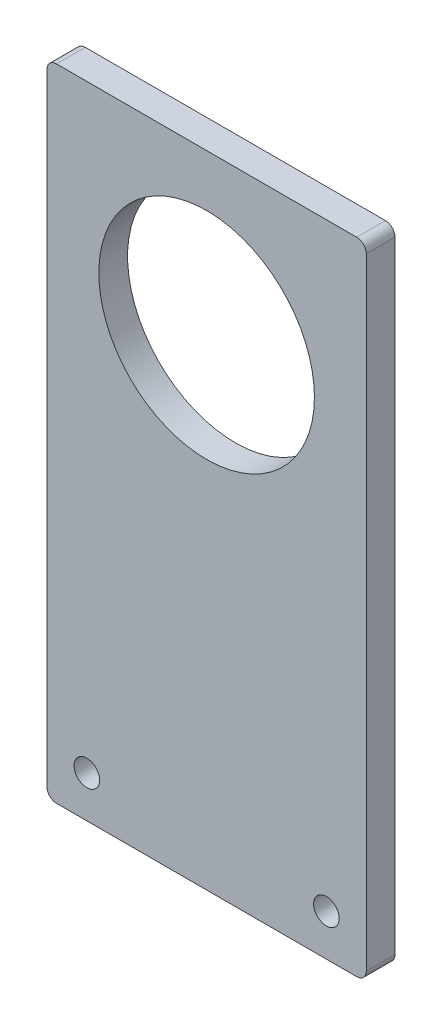
from build123d import *

# Parameters (mm, degrees)
SKETCH_1_R          = 6.75
EXTRUDE_1_DEPTH     = 1.8
SKETCH_2_R          = 0.8
CUT_EXTRUDE_1_DEPTH = 2
SKETCH_3_R          = 1.75
CUT_EXTRUDE_2_DEPTH = 0.5
CUT_EXTRUDE_4_DEPTH = 10
SKETCH_6_R          = 1.75
EXTRUDE_2_DEPTH     = 1.8


with BuildPart() as part:
    # 草图1 → 凸台-拉伸1 (new body)
    with BuildSketch(Plane.XY):
        with BuildLine():
            Line((0.7, 0), (19.5, 0))
            ThreePointArc((19.5, 0), (19.994974747, -0.205025253), (20.2, -0.7))
            Line((20.2, -0.7), (20.2, -39.6))
            ThreePointArc((20.2, -39.6), (19.994974747, -40.094974747), (19.5, -40.3))
            Line((19.5, -40.3), (0.7, -40.3))
            ThreePointArc((0.7, -40.3), (0.205025253, -40.094974747), (0, -39.6))
            Line((0, -39.6), (0, -0.7))
            ThreePointArc((0, -0.7), (0.205025253, -0.205025253), (0.7, 0))
        make_face()
        with Locations((10.1, -10.1)):
            Circle(SKETCH_1_R, mode=Mode.SUBTRACT)
    extrude(amount=EXTRUDE_1_DEPTH)

    # 草图2 → 切除-拉伸1 (cut)
    with BuildSketch(Plane.XY.offset(1.8)):
        with Locations((17.6, -2.6)):
            Circle(SKETCH_2_R)
        with Locations((17.6, -37.6)):
            Circle(SKETCH_2_R)
        with Locations((2.6, -37.6)):
            Circle(SKETCH_2_R)
        with Locations((2.6, -2.6)):
            Circle(SKETCH_2_R)
    extrude(amount=-CUT_EXTRUDE_1_DEPTH, mode=Mode.SUBTRACT)

    # 草图3 → 切除-拉伸2 (cut)
    with BuildSketch(Plane(origin=(0, 0, 0), x_dir=(-1, 0, 0), z_dir=(0, 0, -1))):
        with Locations((-17.6, -2.6)):
            Circle(SKETCH_3_R)
        with Locations((-2.6, -2.6)):
            Circle(SKETCH_3_R)
        with Locations((-17.6, -37.6)):
            Circle(SKETCH_3_R)
        with Locations((-2.6, -37.6)):
            Circle(SKETCH_3_R)
    extrude(amount=-CUT_EXTRUDE_2_DEPTH, mode=Mode.SUBTRACT)

    # 草图4 → 切除-拉伸4 (cut)
    with BuildSketch(Plane(origin=(0, 0, 0), x_dir=(-1, 0, 0), z_dir=(0, 0, -1))):
        with BuildLine():
            Line((-19.5, -40.3), (-0.7, -40.3))
            ThreePointArc((-0.7, -40.3), (-0.205025253, -40.094974747), (0, -39.6))
            Line((0, -39.6), (0, -0.7))
            ThreePointArc((0, -0.7), (-0.205025253, -0.205025253), (-0.7, 0))
            Line((-0.7, 0), (-19.5, 0))
            ThreePointArc((-19.5, 0), (-19.994974747, -0.205025253), (-20.2, -0.7))
            Line((-20.2, -0.7), (-20.2, -39.6))
            ThreePointArc((-20.2, -39.6), (-19.994974747, -40.094974747), (-19.5, -40.3))
        make_face()
        with BuildLine():
            Line((-0.7, -0.1), (-19.5, -0.1))
            ThreePointArc((-19.5, -0.1), (-19.924264069, -0.275735931), (-20.1, -0.7))
            Line((-20.1, -0.7), (-20.1, -39.6))
            ThreePointArc((-20.1, -39.6), (-19.924264069, -40.024264069), (-19.5, -40.2))
            Line((-19.5, -40.2), (-0.7, -40.2))
            ThreePointArc((-0.7, -40.2), (-0.275735931, -40.024264069), (-0.1, -39.6))
            Line((-0.1, -39.6), (-0.1, -0.7))
            ThreePointArc((-0.1, -0.7), (-0.275735931, -0.275735931), (-0.7, -0.1))
        make_face(mode=Mode.SUBTRACT)
    extrude(amount=-CUT_EXTRUDE_4_DEPTH, mode=Mode.SUBTRACT)

    # 草图6 → 凸台-拉伸2 (add)
    with BuildSketch(Plane(origin=(0, 0, 0), x_dir=(-1, 0, 0), z_dir=(0, 0, -1))):
        with Locations((-17.6, -2.6)):
            Circle(SKETCH_6_R)
        with Locations((-2.6, -2.6)):
            Circle(SKETCH_6_R)
    extrude(amount=-EXTRUDE_2_DEPTH)


solid = part.part
